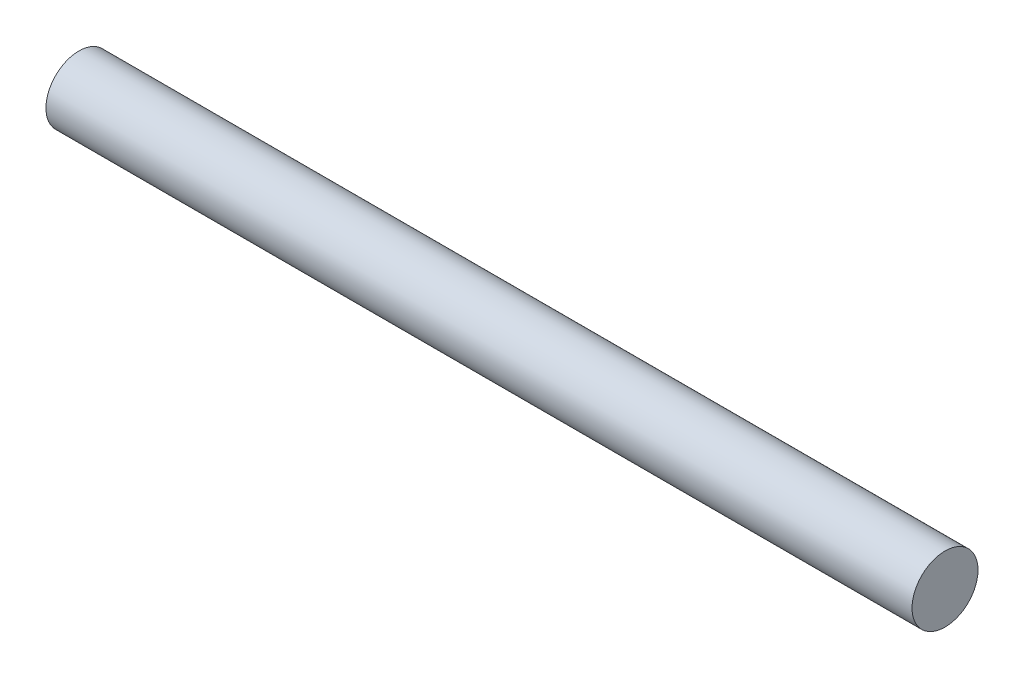
from build123d import *

# Parameters (mm, degrees)
SKETCH_1_R      = 4
EXTRUDE_1_DEPTH = 105


with BuildPart() as part:
    # 草图1 → 凸台-拉伸1 (new body)
    with BuildSketch(Plane(origin=(0, 0, 0), x_dir=(0, 0, -1), z_dir=(1, 0, 0))):
        Circle(SKETCH_1_R)
    extrude(amount=EXTRUDE_1_DEPTH)


solid = part.part
